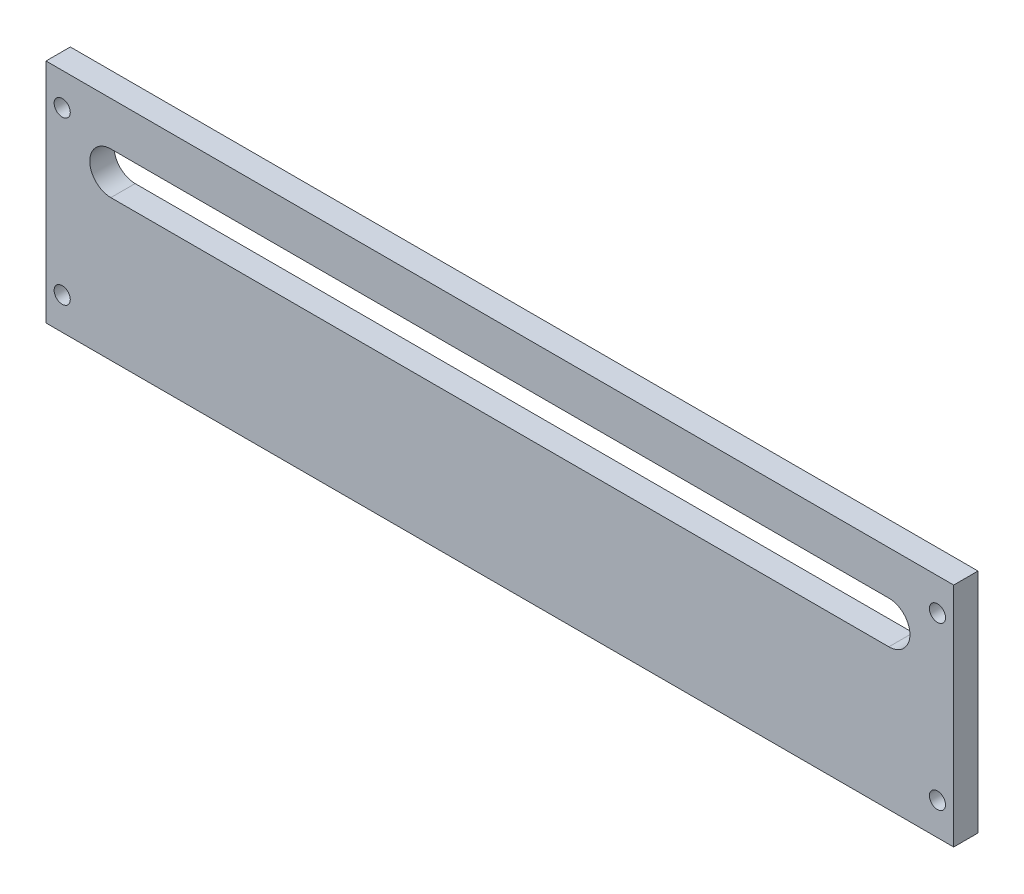
from build123d import *

# Parameters (mm, degrees)
SKETCH1_W           = 355.6
SKETCH1_H           = 88.9
BOSS_EXTRUDE1_DEPTH = 9.525
SKETCH2_R           = 3.1623
CUT_EXTRUDE1_DEPTH  = 367.667827366
CUT_EXTRUDE2_DEPTH  = 367.667827366


with BuildPart() as part:
    # Sketch1 → Boss-Extrude1 (new body)
    with BuildSketch(Plane.XY):
        with Locations((177.8, 44.45)):
            Rectangle(SKETCH1_W, SKETCH1_H)
    extrude(amount=BOSS_EXTRUDE1_DEPTH)

    # Sketch2 → Cut-Extrude1 (cut, through all)
    with BuildSketch(Plane.XY.offset(9.525)):
        with Locations((6.35, 76.2)):
            Circle(SKETCH2_R)
        with Locations((6.35, 12.7)):
            Circle(SKETCH2_R)
        with Locations((349.25, 76.2)):
            Circle(SKETCH2_R)
        with Locations((349.25, 12.7)):
            Circle(SKETCH2_R)
    extrude(amount=-CUT_EXTRUDE1_DEPTH, mode=Mode.SUBTRACT)

    # Sketch3 → Cut-Extrude2 (cut, through all)
    with BuildSketch(Plane.XY.offset(9.525)):
        with BuildLine():
            Line((25.4, 71.755), (330.2, 71.755))
            ThreePointArc((330.2, 71.755), (338.455, 63.5), (330.2, 55.245))
            Line((330.2, 55.245), (25.4, 55.245))
            ThreePointArc((25.4, 55.245), (17.145, 63.5), (25.4, 71.755))
        make_face()
    extrude(amount=-CUT_EXTRUDE2_DEPTH, mode=Mode.SUBTRACT)


solid = part.part
